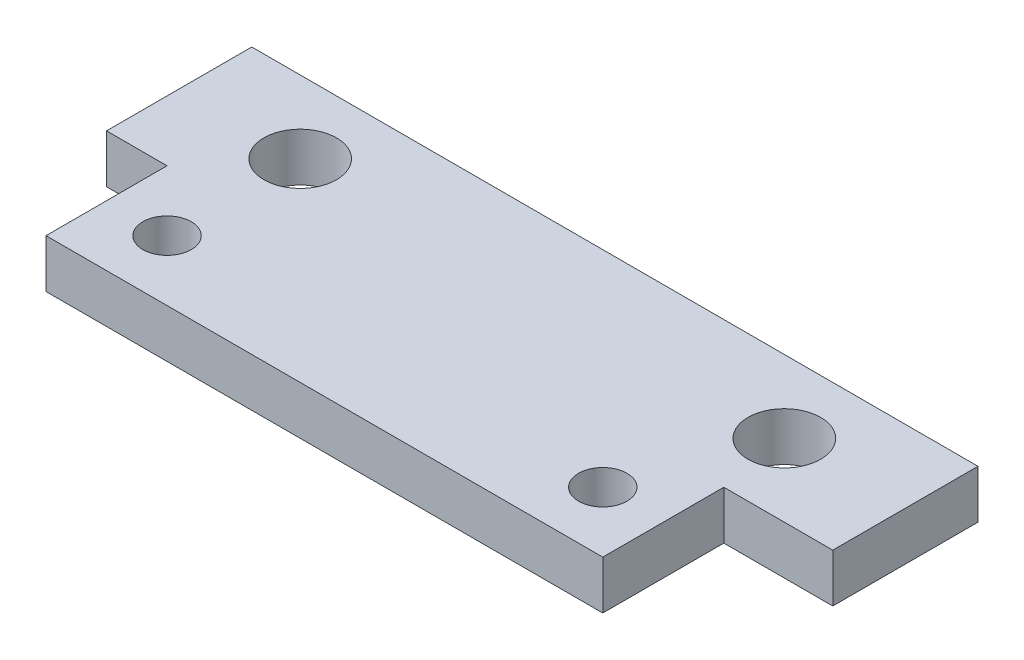
from build123d import *

# Parameters (mm, degrees)
SKETCH_1_W      = 30
SKETCH_1_H      = 6
SKETCH_1_R      = 1.5
EXTRUDE_1_DEPTH = 2
SKETCH_2_W      = 23
SKETCH_2_H      = 5
SKETCH_2_R      = 1
EXTRUDE_2_DEPTH = 2


with BuildPart() as part:
    # 草图1 → 凸台-拉伸1 (new body)
    with BuildSketch(Plane(origin=(0, 0, 0), x_dir=(1, 0, 0), z_dir=(0, 1, 0))):
        with Locations((15, 3)):
            Rectangle(SKETCH_1_W, SKETCH_1_H)
        with Locations(Location((5, 3, 0), (0, 0, 270))):
            Circle(SKETCH_1_R, mode=Mode.SUBTRACT)
        with Locations(Location((25, 3, 0), (0, 0, 270))):
            Circle(SKETCH_1_R, mode=Mode.SUBTRACT)
    extrude(amount=EXTRUDE_1_DEPTH)

    # 草图2 → 凸台-拉伸2 (add)
    with BuildSketch(Plane(origin=(0, 2, 0), x_dir=(1, 0, 0), z_dir=(0, 1, 0))):
        with Locations((14, -2.5)):
            Rectangle(SKETCH_2_W, SKETCH_2_H)
        with Locations(Location((5, -2.5, 0), (0, 0, 270))):
            Circle(SKETCH_2_R, mode=Mode.SUBTRACT)
        with Locations(Location((23, -2.5, 0), (0, 0, 270))):
            Circle(SKETCH_2_R, mode=Mode.SUBTRACT)
    extrude(amount=-EXTRUDE_2_DEPTH)


solid = part.part
